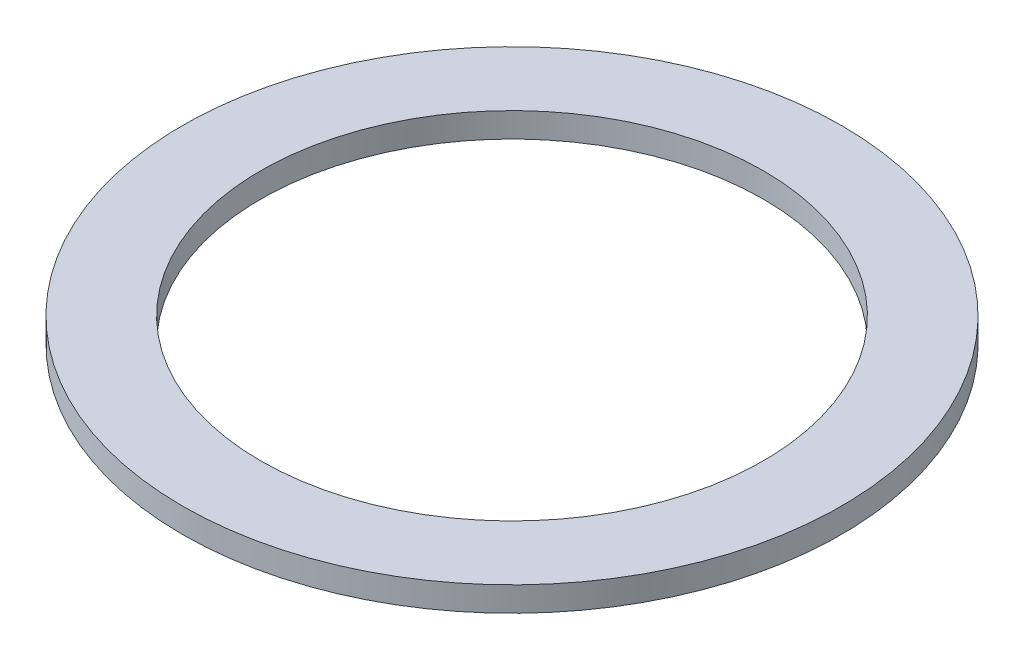
from build123d import *

# Parameters (mm, degrees)
SKETCH1_R           = 6.7945
SKETCH1_R_2         = 5.1816
BOSS_EXTRUDE1_DEPTH = 0.508


with BuildPart() as part:
    # Sketch1 → Boss-Extrude1 (new body)
    with BuildSketch(Plane(origin=(0, 0, 0), x_dir=(1, 0, 0), z_dir=(0, 1, 0))):
        with Locations(Location((0, 0, 0), (0, 0, 270))):
            Circle(SKETCH1_R)
        with Locations(Location((0, 0, 0), (0, 0, 270))):
            Circle(SKETCH1_R_2, mode=Mode.SUBTRACT)
    extrude(amount=BOSS_EXTRUDE1_DEPTH)


solid = part.part
